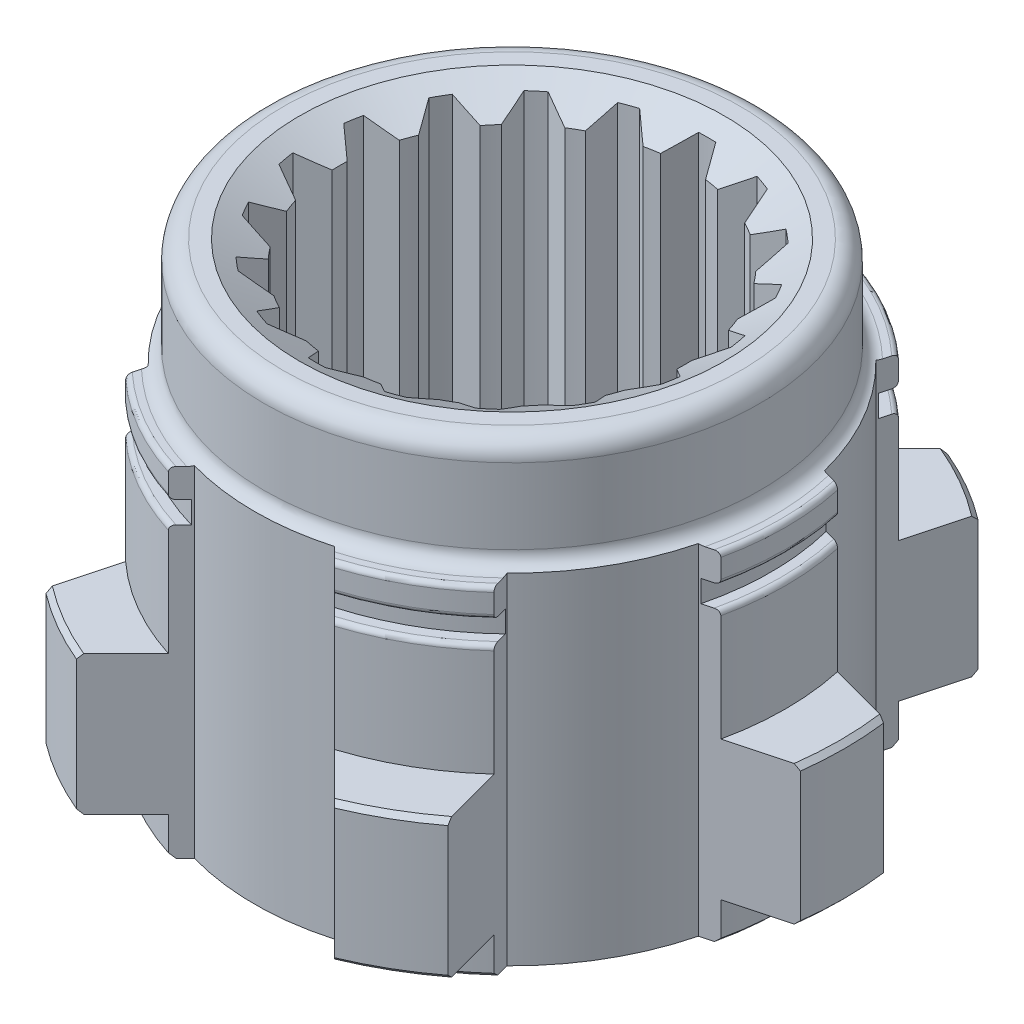
from build123d import *

# Parameters (mm, degrees)
CHANFRO2_SIZE         = 4.2
CHANFRO2_SIZE2        = 2.424871131
CHANFRO3_SIZE         = 4.2
CHANFRO3_SIZE2        = 2.424871131
FILETE1_R             = 2
FILETE2_R             = 1.5
FILETE4_R             = 0.5
CHANFRO4_SIZE         = 0.5
CORTE_EXTRUS_O1_DEPTH = 69.154383571
CORTE_EXTRUS_O2_DEPTH = 67.796429261


with BuildPart() as part:
    # Esboço1 → Revolução1 (revolve)
    with BuildSketch(Plane.XY, mode=Mode.PRIVATE) as revolu_o1_sk:
        Polygon((18.1, 17.993729441), (26, 17.993729441), (26, 6.593729441), (28.7, 6.593729441), (28.7, 3.593729441), (27.2, 3.593729441), (27.2, 1.293729441), (28.7, 1.293729441), (28.7, -10.406270559), (34.9, -10.406270559), (34.9, -25.006270559), (28.7, -25.006270559), (28.7, -29.006270559), (18.1, -29.006270559), align=None)
    revolve(revolu_o1_sk.sketch.rotate(Axis((0, -54.461261261, 0), (0, 1, 0)), 90), axis=Axis((0, -54.461261261, 0), (0, 1, 0)))

    # Chanfro2
    chanfro2_edges = [part.edges().sort_by_distance(p)[0] for p in [
        (0, 17.993729441, 18.1),
    ]]
    chanfro2_side = [part.faces().sort_by_distance(p)[0] for p in [
        (0, 17.993729441, 18.835391052),
    ]]
    chamfer(chanfro2_edges, length=CHANFRO2_SIZE, length2=CHANFRO2_SIZE2, reference=chanfro2_side[0])

    # Chanfro3
    chanfro3_edges = [part.edges().sort_by_distance(p)[0] for p in [
        (0, -29.006270559, 18.1),
    ]]
    chanfro3_side = [part.faces().sort_by_distance(p)[0] for p in [
        (0, -6.718706124, 18.1),
    ]]
    chamfer(chanfro3_edges, length=CHANFRO3_SIZE, length2=CHANFRO3_SIZE2, reference=chanfro3_side[0])

    # Filete1
    filete1_edges = [part.edges().sort_by_distance(p)[0] for p in [
        (0, 17.993729441, 26),
    ]]
    fillet(filete1_edges, radius=FILETE1_R)

    # Filete2
    filete2_edges = [part.edges().sort_by_distance(p)[0] for p in [
        (0, 6.593729441, 26),
    ]]
    fillet(filete2_edges, radius=FILETE2_R)

    # Filete4
    filete4_edges = [part.edges().sort_by_distance(p)[0] for p in [
        (0, 1.293729441, 28.7),
        (0, 3.593729441, 28.7),
        (0, 6.593729441, 28.7),
    ]]
    fillet(filete4_edges, radius=FILETE4_R)

    # Chanfro4
    chanfro4_edges = [part.edges().sort_by_distance(p)[0] for p in [
        (0, -25.006270559, 34.9),
        (0, -10.406270559, 34.9),
        (0, -29.006270559, 28.7),
    ]]
    chamfer(chanfro4_edges, length=CHANFRO4_SIZE)

    # Esboço2 → Corte-extrusão1 (cut, through all)
    with BuildSketch(Plane.XZ.offset(29.006270559)):
        with BuildLine():
            Line((-7.35, -25.980329097), (-15.89092927, -34.521258367))
            ThreePointArc((-15.89092927, -34.521258367), (0, -36.655743436), (15.89092927, -34.521258367))
            Line((15.89092927, -34.521258367), (7.35, -25.980329097))
            ThreePointArc((7.35, -25.980329097), (0, -27), (-7.35, -25.980329097))
        make_face()
        with BuildLine():
            Line((-26.174624997, -6.624877831), (-37.841751352, -3.498680746))
            ThreePointArc((-37.841751352, -3.498680746), (-31.74480501, -18.327871718), (-21.950822082, -31.022577622))
            Line((-21.950822082, -31.022577622), (-18.824624997, -19.355451266))
            ThreePointArc((-18.824624997, -19.355451266), (-23.382685902, -13.5), (-26.174624997, -6.624877831))
        make_face()
        with BuildLine():
            Line((-18.824624997, 19.355451266), (-21.950822082, 31.022577622))
            ThreePointArc((-21.950822082, 31.022577622), (-31.74480501, 18.327871718), (-37.841751352, 3.498680746))
            Line((-37.841751352, 3.498680746), (-26.174624997, 6.624877831))
            ThreePointArc((-26.174624997, 6.624877831), (-23.382685902, 13.5), (-18.824624997, 19.355451266))
        make_face()
        with BuildLine():
            Line((7.35, 25.980329097), (15.89092927, 34.521258367))
            ThreePointArc((15.89092927, 34.521258367), (0, 36.655743436), (-15.89092927, 34.521258367))
            Line((-15.89092927, 34.521258367), (-7.35, 25.980329097))
            ThreePointArc((-7.35, 25.980329097), (0, 27), (7.35, 25.980329097))
        make_face()
        with BuildLine():
            Line((26.174624997, 6.624877831), (37.841751352, 3.498680746))
            ThreePointArc((37.841751352, 3.498680746), (31.74480501, 18.327871718), (21.950822082, 31.022577622))
            Line((21.950822082, 31.022577622), (18.824624997, 19.355451266))
            ThreePointArc((18.824624997, 19.355451266), (23.382685902, 13.5), (26.174624997, 6.624877831))
        make_face()
        with BuildLine():
            Line((18.824624997, -19.355451266), (21.950822082, -31.022577622))
            ThreePointArc((21.950822082, -31.022577622), (31.74480501, -18.327871718), (37.841751352, -3.498680746))
            Line((37.841751352, -3.498680746), (26.174624997, -6.624877831))
            ThreePointArc((26.174624997, -6.624877831), (23.382685902, -13.5), (18.824624997, -19.355451266))
        make_face()
    extrude(amount=-CORTE_EXTRUS_O1_DEPTH, mode=Mode.SUBTRACT)

    # Esboço3 → Corte-extrusão2 (cut, through all)
    with BuildSketch(Plane(origin=(0, 17.993729441, 0), x_dir=(1, 0, 0), z_dir=(0, 1, 0))):
        with BuildLine():
            ThreePointArc((-8.119482411, 14.063356067), (-5.372810477, 14.761675464), (-2.819866649, 15.992258458))
            ThreePointArc((-2.819866649, 15.992258458), (-3.117575042, 16.056003212), (-3.413846236, 16.12612497))
            Line((-3.413846236, 16.12612497), (-2.9769134, 16.882914842))
            Line((-2.9769134, 16.882914842), (-6.158929337, 19.552943242))
            ThreePointArc((-6.158929337, 19.552943242), (-7.011412938, 19.263698726), (-7.850376055, 18.937306984))
            Line((-7.850376055, 18.937306984), (-8.571680509, 14.846586147))
            Line((-8.571680509, 14.846586147), (-7.750515384, 14.547706484))
            ThreePointArc((-7.750515384, 14.547706484), (-7.932398889, 14.303550649), (-8.119482411, 14.063356067))
        make_face()
        with BuildLine():
            ThreePointArc((-15.259635413, 5.554053076), (-13.604433696, 7.854523457), (-12.439768764, 10.438205382))
            ThreePointArc((-12.439768764, 10.438205382), (-12.708800963, 10.29567343), (-12.980831262, 10.15895036))
            Line((-12.980831262, 10.15895036), (-13.132576444, 11.01954005))
            Line((-13.132576444, 11.01954005), (-17.286403243, 11.01954005))
            ThreePointArc((-17.286403243, 11.01954005), (-17.753520778, 10.25), (-18.186403243, 9.460694323))
            Line((-18.186403243, 9.460694323), (-16.109489843, 5.863374792))
            Line((-16.109489843, 5.863374792), (-15.288324718, 6.162254455))
            ThreePointArc((-15.288324718, 6.162254455), (-15.270715221, 5.858307771), (-15.259635413, 5.554053076))
        make_face()
        with BuildLine():
            ThreePointArc((-16.238964822, 0), (-15.470391193, 2.727847369), (-15.259635413, 5.554053076))
            ThreePointArc((-15.259635413, 5.554053076), (-15.463694186, 5.328102421), (-15.672557007, 5.106584919))
            Line((-15.672557007, 5.106584919), (-16.109489843, 5.863374792))
            Line((-16.109489843, 5.863374792), (-20.012810235, 4.442682355))
            ThreePointArc((-20.012810235, 4.442682355), (-20.188558937, 3.559787642), (-20.325376955, 2.670028399))
            Line((-20.325376955, 2.670028399), (-17.143361017, 0))
            Line((-17.143361017, 0), (-16.473941074, 0.561710027))
            ThreePointArc((-16.473941074, 0.561710027), (-16.353437671, 0.282116374), (-16.238964822, 0))
        make_face()
        with BuildLine():
            ThreePointArc((-15.259635413, -5.554053076), (-15.470391193, -2.727847369), (-16.238964822, 0))
            ThreePointArc((-16.238964822, 0), (-16.353437671, -0.282116374), (-16.473941074, -0.561710027))
            Line((-16.473941074, -0.561710027), (-17.143361017, 0))
            Line((-17.143361017, 0), (-20.325376955, -2.670028399))
            ThreePointArc((-20.325376955, -2.670028399), (-20.188558937, -3.559787642), (-20.012810235, -4.442682355))
            Line((-20.012810235, -4.442682355), (-16.109489843, -5.863374792))
            Line((-16.109489843, -5.863374792), (-15.672557007, -5.106584919))
            ThreePointArc((-15.672557007, -5.106584919), (-15.463694186, -5.328102421), (-15.259635413, -5.554053076))
        make_face()
        with BuildLine():
            ThreePointArc((-12.439768764, -10.438205382), (-13.604433696, -7.854523457), (-15.259635413, -5.554053076))
            ThreePointArc((-15.259635413, -5.554053076), (-15.270715221, -5.858307771), (-15.288324718, -6.162254455))
            Line((-15.288324718, -6.162254455), (-16.109489843, -5.863374792))
            Line((-16.109489843, -5.863374792), (-18.186403243, -9.460694323))
            ThreePointArc((-18.186403243, -9.460694323), (-17.753520778, -10.25), (-17.286403243, -11.01954005))
            Line((-17.286403243, -11.01954005), (-13.132576444, -11.01954005))
            Line((-13.132576444, -11.01954005), (-12.980831262, -10.15895036))
            ThreePointArc((-12.980831262, -10.15895036), (-12.708800963, -10.29567343), (-12.439768764, -10.438205382))
        make_face()
        with BuildLine():
            ThreePointArc((-8.119482411, -14.063356067), (-10.097580716, -12.033828095), (-12.439768764, -10.438205382))
            ThreePointArc((-12.439768764, -10.438205382), (-12.346119144, -10.727900791), (-12.25871077, -11.01954005))
            Line((-12.25871077, -11.01954005), (-13.132576444, -11.01954005))
            Line((-13.132576444, -11.01954005), (-13.853880898, -15.110260887))
            ThreePointArc((-13.853880898, -15.110260887), (-13.177145999, -15.703911084), (-12.4750009, -16.267278584))
            Line((-12.4750009, -16.267278584), (-8.571680509, -14.846586147))
            Line((-8.571680509, -14.846586147), (-8.72342569, -13.985996457))
            ThreePointArc((-8.72342569, -13.985996457), (-8.421038782, -14.021434275), (-8.119482411, -14.063356067))
        make_face()
        with BuildLine():
            ThreePointArc((-2.819866649, -15.992258458), (-5.372810477, -14.761675464), (-8.119482411, -14.063356067))
            ThreePointArc((-8.119482411, -14.063356067), (-7.932398889, -14.303550649), (-7.750515384, -14.547706484))
            Line((-7.750515384, -14.547706484), (-8.571680509, -14.846586147))
            Line((-8.571680509, -14.846586147), (-7.850376055, -18.937306984))
            ThreePointArc((-7.850376055, -18.937306984), (-7.011412938, -19.263698726), (-6.158929337, -19.552943242))
            Line((-6.158929337, -19.552943242), (-2.9769134, -16.882914842))
            Line((-2.9769134, -16.882914842), (-3.413846236, -16.12612497))
            ThreePointArc((-3.413846236, -16.12612497), (-3.117575042, -16.056003212), (-2.819866649, -15.992258458))
        make_face()
        with BuildLine():
            ThreePointArc((2.819866649, -15.992258458), (0, -15.709046913), (-2.819866649, -15.992258458))
            ThreePointArc((-2.819866649, -15.992258458), (-2.561914258, -16.153981201), (-2.307493457, -16.321204815))
            Line((-2.307493457, -16.321204815), (-2.9769134, -16.882914842))
            Line((-2.9769134, -16.882914842), (-0.9, -20.480234374))
            ThreePointArc((-0.9, -20.480234374), (0, -20.5), (0.9, -20.480234374))
            Line((0.9, -20.480234374), (2.9769134, -16.882914842))
            Line((2.9769134, -16.882914842), (2.307493457, -16.321204815))
            ThreePointArc((2.307493457, -16.321204815), (2.561914258, -16.153981201), (2.819866649, -15.992258458))
        make_face()
        with BuildLine():
            ThreePointArc((7.750515384, -14.547706484), (7.932398889, -14.303550649), (8.119482411, -14.063356067))
            ThreePointArc((8.119482411, -14.063356067), (5.372810477, -14.761675464), (2.819866649, -15.992258458))
            ThreePointArc((2.819866649, -15.992258458), (3.117575042, -16.056003212), (3.413846236, -16.12612497))
            Line((3.413846236, -16.12612497), (2.9769134, -16.882914842))
            Line((2.9769134, -16.882914842), (6.158929337, -19.552943242))
            ThreePointArc((6.158929337, -19.552943242), (7.011412938, -19.263698726), (7.850376055, -18.937306984))
            Line((7.850376055, -18.937306984), (8.571680509, -14.846586147))
            Line((8.571680509, -14.846586147), (7.750515384, -14.547706484))
        make_face()
        with BuildLine():
            ThreePointArc((12.25871077, -11.01954005), (12.346119144, -10.727900791), (12.439768764, -10.438205382))
            ThreePointArc((12.439768764, -10.438205382), (10.097580716, -12.033828095), (8.119482411, -14.063356067))
            ThreePointArc((8.119482411, -14.063356067), (8.421038782, -14.021434275), (8.72342569, -13.985996457))
            Line((8.72342569, -13.985996457), (8.571680509, -14.846586147))
            Line((8.571680509, -14.846586147), (12.4750009, -16.267278584))
            ThreePointArc((12.4750009, -16.267278584), (13.177145999, -15.703911084), (13.853880898, -15.110260887))
            Line((13.853880898, -15.110260887), (13.132576444, -11.01954005))
            Line((13.132576444, -11.01954005), (12.25871077, -11.01954005))
        make_face()
        with BuildLine():
            ThreePointArc((15.288324718, -6.162254455), (15.270715221, -5.858307771), (15.259635413, -5.554053076))
            ThreePointArc((15.259635413, -5.554053076), (13.604433696, -7.854523457), (12.439768764, -10.438205382))
            ThreePointArc((12.439768764, -10.438205382), (12.708800963, -10.29567343), (12.980831262, -10.15895036))
            Line((12.980831262, -10.15895036), (13.132576444, -11.01954005))
            Line((13.132576444, -11.01954005), (17.286403243, -11.01954005))
            ThreePointArc((17.286403243, -11.01954005), (17.753520778, -10.25), (18.186403243, -9.460694323))
            Line((18.186403243, -9.460694323), (16.109489843, -5.863374792))
            Line((16.109489843, -5.863374792), (15.288324718, -6.162254455))
        make_face()
        with BuildLine():
            ThreePointArc((16.473941074, -0.561710027), (16.353437671, -0.282116374), (16.238964822, 0))
            ThreePointArc((16.238964822, 0), (15.470391193, -2.727847369), (15.259635413, -5.554053076))
            ThreePointArc((15.259635413, -5.554053076), (15.463694186, -5.328102421), (15.672557007, -5.106584919))
            Line((15.672557007, -5.106584919), (16.109489843, -5.863374792))
            Line((16.109489843, -5.863374792), (20.012810235, -4.442682355))
            ThreePointArc((20.012810235, -4.442682355), (20.188558937, -3.559787642), (20.325376955, -2.670028399))
            Line((20.325376955, -2.670028399), (17.143361017, 0))
            Line((17.143361017, 0), (16.473941074, -0.561710027))
        make_face()
        with BuildLine():
            ThreePointArc((15.672557007, 5.106584919), (15.463694186, 5.328102421), (15.259635413, 5.554053076))
            ThreePointArc((15.259635413, 5.554053076), (15.470391193, 2.727847369), (16.238964822, 0))
            ThreePointArc((16.238964822, 0), (16.353437671, 0.282116374), (16.473941074, 0.561710027))
            Line((16.473941074, 0.561710027), (17.143361017, 0))
            Line((17.143361017, 0), (20.325376955, 2.670028399))
            ThreePointArc((20.325376955, 2.670028399), (20.188558937, 3.559787642), (20.012810235, 4.442682355))
            Line((20.012810235, 4.442682355), (16.109489843, 5.863374792))
            Line((16.109489843, 5.863374792), (15.672557007, 5.106584919))
        make_face()
        with BuildLine():
            ThreePointArc((12.980831262, 10.15895036), (12.708800963, 10.29567343), (12.439768764, 10.438205382))
            ThreePointArc((12.439768764, 10.438205382), (13.604433696, 7.854523457), (15.259635413, 5.554053076))
            ThreePointArc((15.259635413, 5.554053076), (15.270715221, 5.858307771), (15.288324718, 6.162254455))
            Line((15.288324718, 6.162254455), (16.109489843, 5.863374792))
            Line((16.109489843, 5.863374792), (18.186403243, 9.460694323))
            ThreePointArc((18.186403243, 9.460694323), (17.753520778, 10.25), (17.286403243, 11.01954005))
            Line((17.286403243, 11.01954005), (13.132576444, 11.01954005))
            Line((13.132576444, 11.01954005), (12.980831262, 10.15895036))
        make_face()
        with BuildLine():
            ThreePointArc((8.72342569, 13.985996457), (8.421038782, 14.021434275), (8.119482411, 14.063356067))
            ThreePointArc((8.119482411, 14.063356067), (10.097580716, 12.033828095), (12.439768764, 10.438205382))
            ThreePointArc((12.439768764, 10.438205382), (12.346119144, 10.727900791), (12.25871077, 11.01954005))
            Line((12.25871077, 11.01954005), (13.132576444, 11.01954005))
            Line((13.132576444, 11.01954005), (13.853880898, 15.110260887))
            ThreePointArc((13.853880898, 15.110260887), (13.177145999, 15.703911084), (12.4750009, 16.267278584))
            Line((12.4750009, 16.267278584), (8.571680509, 14.846586147))
            Line((8.571680509, 14.846586147), (8.72342569, 13.985996457))
        make_face()
        with BuildLine():
            ThreePointArc((3.413846236, 16.12612497), (3.117575042, 16.056003212), (2.819866649, 15.992258458))
            ThreePointArc((2.819866649, 15.992258458), (5.372810477, 14.761675464), (8.119482411, 14.063356067))
            ThreePointArc((8.119482411, 14.063356067), (7.932398889, 14.303550649), (7.750515384, 14.547706484))
            Line((7.750515384, 14.547706484), (8.571680509, 14.846586147))
            Line((8.571680509, 14.846586147), (7.850376055, 18.937306984))
            ThreePointArc((7.850376055, 18.937306984), (7.011412938, 19.263698726), (6.158929337, 19.552943242))
            Line((6.158929337, 19.552943242), (2.9769134, 16.882914842))
            Line((2.9769134, 16.882914842), (3.413846236, 16.12612497))
        make_face()
        with BuildLine():
            ThreePointArc((-2.819866649, 15.992258458), (-1.417026525, 15.780027453), (0, 15.709046913))
            Line((0, 15.709046913), (0, 20.5))
            ThreePointArc((0, 20.5), (-0.450108509, 20.495057998), (-0.9, 20.480234374))
            Line((-0.9, 20.480234374), (-2.9769134, 16.882914842))
            Line((-2.9769134, 16.882914842), (-2.307493457, 16.321204815))
            ThreePointArc((-2.307493457, 16.321204815), (-2.561914258, 16.153981201), (-2.819866649, 15.992258458))
        make_face()
        with BuildLine():
            Line((0, 20.5), (0, 15.709046913))
            ThreePointArc((0, 15.709046913), (1.417026525, 15.780027453), (2.819866649, 15.992258458))
            ThreePointArc((2.819866649, 15.992258458), (2.561914258, 16.153981201), (2.307493457, 16.321204815))
            Line((2.307493457, 16.321204815), (2.9769134, 16.882914842))
            Line((2.9769134, 16.882914842), (0.9, 20.480234374))
            ThreePointArc((0.9, 20.480234374), (0.450108509, 20.495057998), (0, 20.5))
        make_face()
        with BuildLine():
            Line((-13.853880898, 15.110260887), (-12.980831262, 10.15895036))
            ThreePointArc((-12.980831262, 10.15895036), (-10.097580716, 12.033828095), (-7.750515384, 14.547706484))
            Line((-7.750515384, 14.547706484), (-12.4750009, 16.267278584))
            ThreePointArc((-12.4750009, 16.267278584), (-13.177145999, 15.703911084), (-13.853880898, 15.110260887))
        make_face()
    extrude(amount=-CORTE_EXTRUS_O2_DEPTH, mode=Mode.SUBTRACT)


solid = part.part
